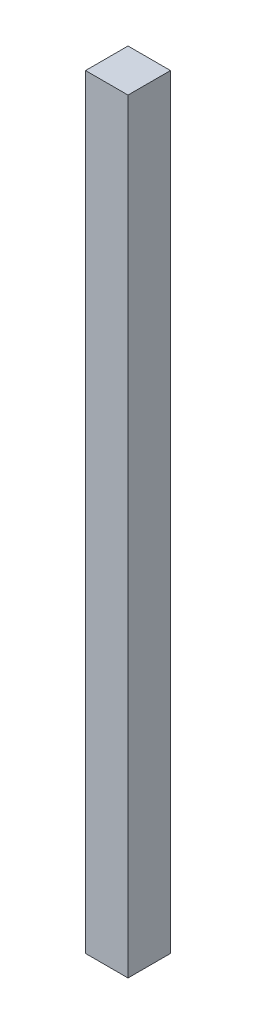
from build123d import *

# Parameters (mm, degrees)
SKETCH1_W           = 15
SKETCH1_H           = 15
BOSS_EXTRUDE1_DEPTH = 270


with BuildPart() as part:
    # Sketch1 → Boss-Extrude1 (new body)
    with BuildSketch(Plane(origin=(0, 0, 0), x_dir=(1, 0, 0), z_dir=(0, 1, 0))):
        with Locations((7.5, 7.5)):
            Rectangle(SKETCH1_W, SKETCH1_H)
    extrude(amount=BOSS_EXTRUDE1_DEPTH)


solid = part.part
